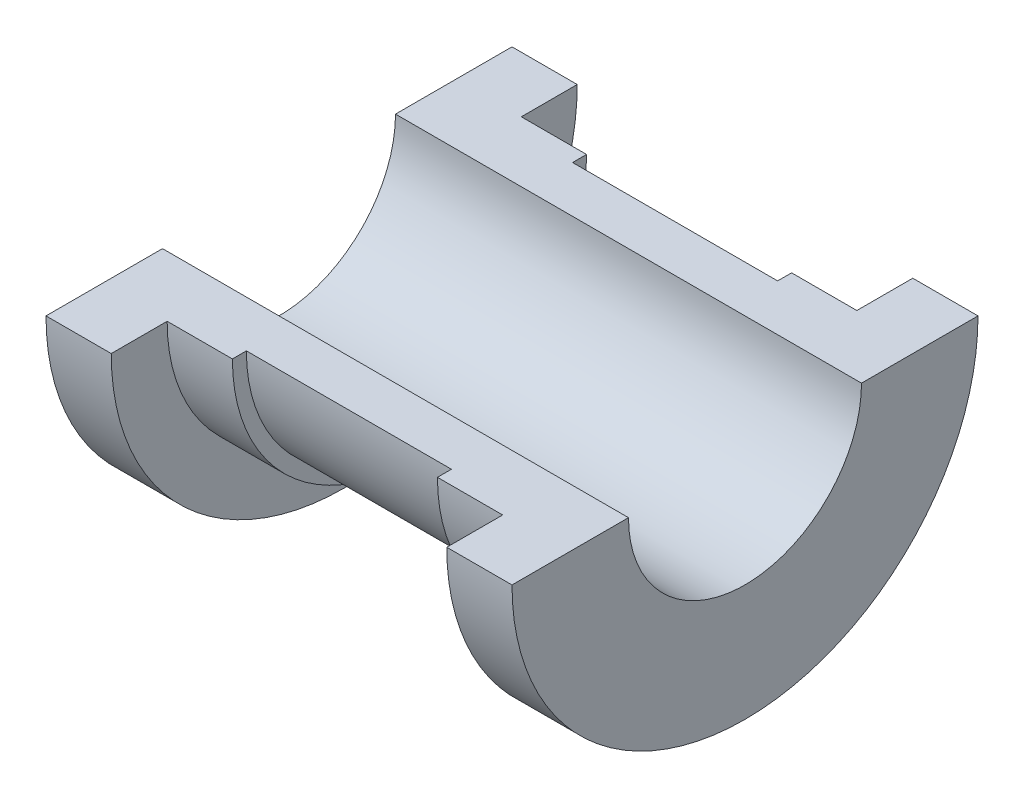
from build123d import *

# Parameters (mm, degrees)
SKETCH2_R               = 12.5
CUT_EXTRUDE1_DEPTH      = 62.23724357
CUT_EXTRUDE4_DEPTH      = 62.23724357
CUT_EXTRUDE4_DEPTH_BACK = 62.23724357
SKETCH5_R               = 3
BOSS_EXTRUDE1_DEPTH     = 2.5


with BuildPart() as part:
    # Sketch1 → Revolve1 (revolve)
    with BuildSketch(Plane.XY, mode=Mode.PRIVATE) as revolve1_sk:
        Polygon((-25, 0), (25, 0), (25, 25), (18, 25), (18, 19), (11, 19), (11, 17.5), (-11, 17.5), (-11, 19), (-18, 19), (-18, 25), (-25, 25), align=None)
    revolve(revolve1_sk.sketch.rotate(Axis((-25, 0, 0), (1, 0, 0)), 90), axis=Axis((-25, 0, 0), (1, 0, 0)))

    # Sketch2 → Cut-Extrude1 (cut, through all)
    with BuildSketch(Plane(origin=(25, 0, 0), x_dir=(0, 0, -1), z_dir=(1, 0, 0))):
        Circle(SKETCH2_R)
    extrude(amount=-CUT_EXTRUDE1_DEPTH, mode=Mode.SUBTRACT)

    # Sketch3 → Cut-Extrude4 (cut, two sides: drawn at the far end of the back side and taken through both)
    with BuildSketch(Plane(origin=(25, 0, 0), x_dir=(0, 0, -1), z_dir=(1, 0, 0)).offset(-CUT_EXTRUDE4_DEPTH_BACK)):
        Polygon((-146.803398875, 0), (-25, 0), (25, 0), (146.803398875, 0), (146.803398875, 243.60679775), (-146.803398875, 243.60679775), align=None)
    extrude(amount=CUT_EXTRUDE4_DEPTH + CUT_EXTRUDE4_DEPTH_BACK, mode=Mode.SUBTRACT)

    # Sketch5 → Boss-Extrude1 (add, symmetric)
    with BuildSketch(Plane(origin=(0, -17.5, 0), x_dir=(1, 0, 0), z_dir=(0, 1, 0))):
        with Locations(Location((0, 0, 0), (0, 0, 90))):
            Circle(SKETCH5_R)
    extrude(amount=BOSS_EXTRUDE1_DEPTH, both=True)


solid = part.part
